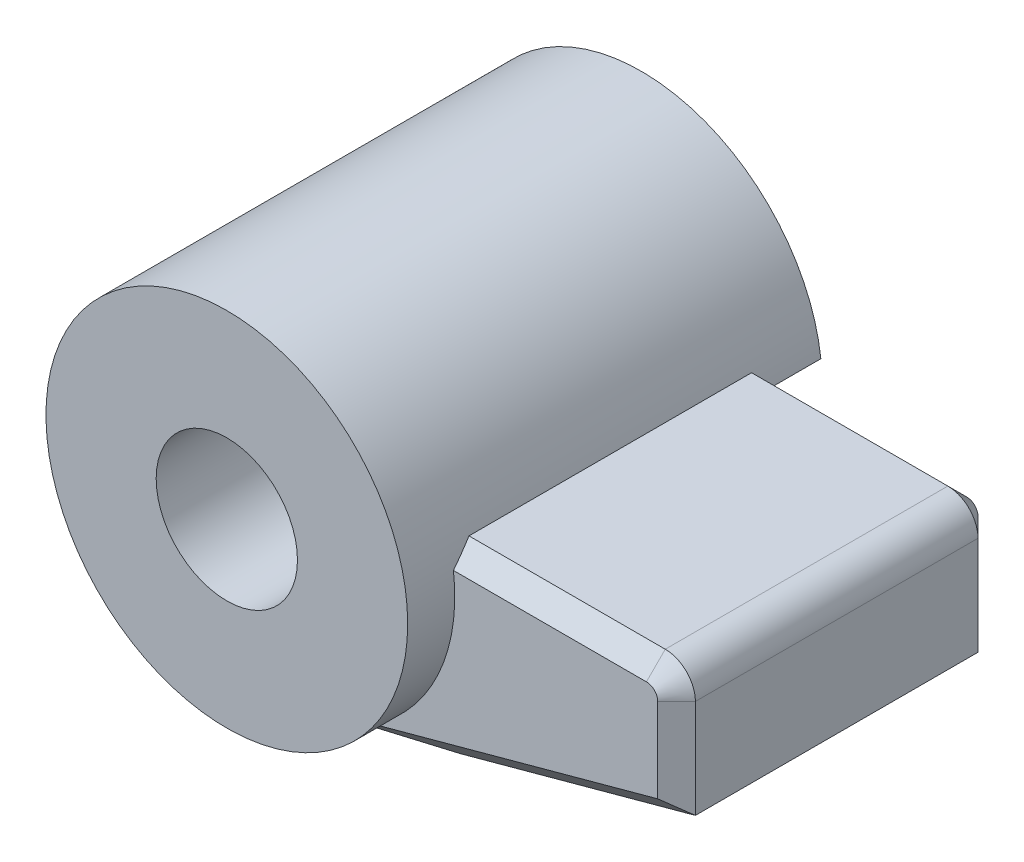
from build123d import *

# Parameters (mm, degrees)
SKETCH_1_R          = 4.8
SKETCH_1_R_2        = 1.875
EXTRUDE_1_DEPTH     = 5.5
EXTRUDE_2_DEPTH     = 4.25
FILLET_1_R          = 0.8
CHAMFER_1_SIZE      = 0.5
SKETCH_3_R          = 4
CUT_EXTRUDE_2_DEPTH = 7
CUT_EXTRUDE_3_DEPTH = 6


with BuildPart() as part:
    # 스케치1 → 보스-돌출1 (new, symmetric)
    with BuildSketch(Plane.XY):
        Circle(SKETCH_1_R)
        Circle(SKETCH_1_R_2, mode=Mode.SUBTRACT)
    extrude(amount=EXTRUDE_1_DEPTH, both=True)

    # 스케치1<3> → 보스-돌출2 (add, symmetric)
    with BuildSketch(Plane.XY):
        with BuildLine():
            Line((10.686006915, 1.08279994), (4.676274617, 1.08279994))
            ThreePointArc((4.676274617, 1.08279994), (4.768968345, 0.544922857), (4.8, 0))
            ThreePointArc((4.8, 0), (4.062561846, -2.556480246), (2.07683698, -4.327441295))
            Line((2.07683698, -4.327441295), (4.463626657, -4.033392343))
            Line((4.463626657, -4.033392343), (10.686006915, -2.337209356))
            Line((10.686006915, -2.337209356), (10.686006915, 1.08279994))
        make_face()
    extrude(amount=EXTRUDE_2_DEPTH, both=True)

    # 필렛1
    fillet_1_edges = [part.edges().sort_by_distance(p)[0] for p in [
        (10.686006915, 1.08279994, 0),
    ]]
    fillet(fillet_1_edges, radius=FILLET_1_R)

    # 모따기1
    chamfer_1_edges = [part.edges().sort_by_distance(p)[0] for p in [
        (7.574816786, -3.185300849, 4.25),
        (7.574816786, -3.185300849, -4.25),
        (7.281140766, 1.08279994, 4.25),
        (10.45169234, 0.848485365, 4.25),
        (10.686006915, -1.027204708, 4.25),
        (7.281140766, 1.08279994, -4.25),
        (10.45169234, 0.848485365, -4.25),
        (10.686006915, -1.027204708, -4.25),
    ]]
    chamfer(chamfer_1_edges, length=CHAMFER_1_SIZE)

    # 스케치3 → 컷-돌출2 (cut)
    with BuildSketch(Plane(origin=(0, 0, -5.5), x_dir=(-1, 0, 0), z_dir=(0, 0, -1))):
        Circle(SKETCH_3_R)
    extrude(amount=-CUT_EXTRUDE_2_DEPTH, mode=Mode.SUBTRACT)

    # 스케치4 → 컷-돌출3 (cut)
    with BuildSketch(Plane(origin=(0, 0, -5.5), x_dir=(-1, 0, 0), z_dir=(0, 0, -1))):
        Polygon((-6.86319087, -1.377175039), (-7.158299806, 0.093508719), (-3.628765777, 0.801748699), (-3.33365684, -0.668935059), (-3.038547903, -2.139618817), (-6.568081933, -2.847858797), align=None)
    extrude(amount=-CUT_EXTRUDE_3_DEPTH, mode=Mode.SUBTRACT)


solid = part.part
